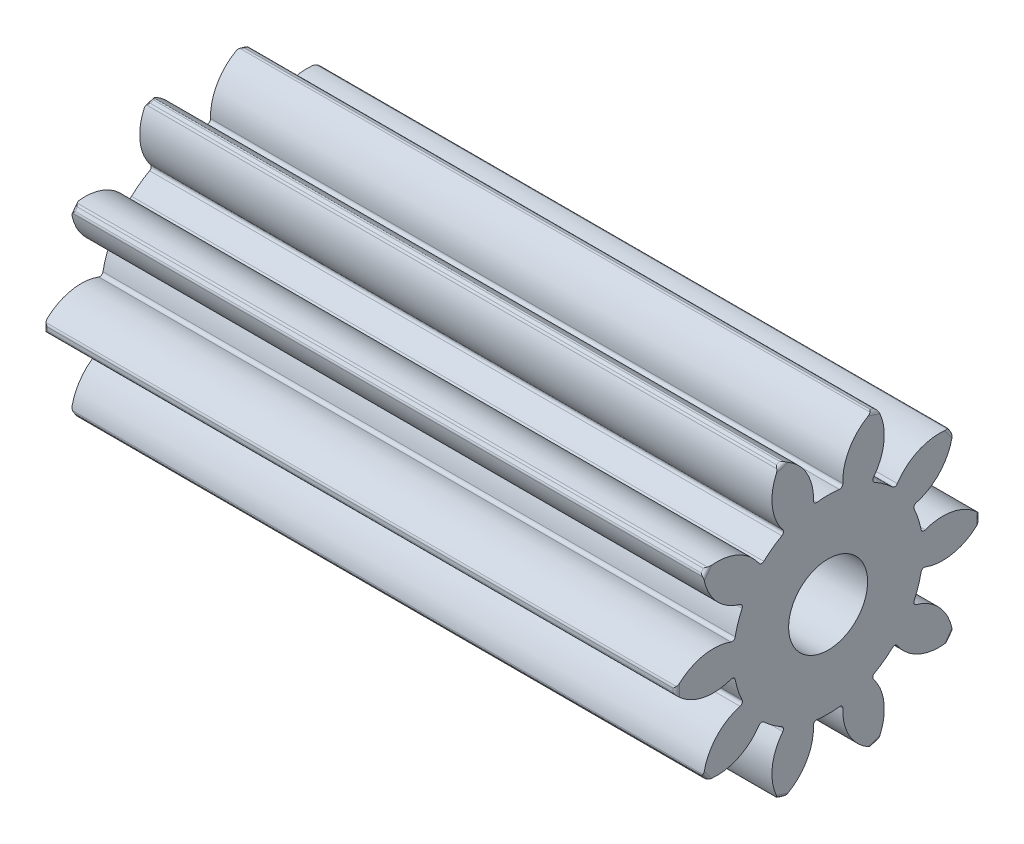
from build123d import *

# Parameters (mm, degrees)
BASPROSKE_W        = 12
BASPROSKE_H        = 2.4
TOOTHCUT_DEPTH     = 13.470765814
TEETHCUTS_COUNT    = 10
TEETHCUTS_ANGLE    = 324
BORSKE_R           = 0.625
BORE_DEPTH         = 50.0000508
SKETCH1_W          = 16.707004502
SKETCH1_H          = 15.29962097
CUT_EXTRUDE1_DEPTH = 2
FILLET1_R          = 0.05
FILLET2_R          = 0.05
FILLET3_R          = 0.05


with BuildPart() as part:
    # BasProSke → Base-Revolve (revolve)
    with BuildSketch(Plane(origin=(0, 0, 0), x_dir=(1, 0, 0), z_dir=(0, 1, 0)), mode=Mode.PRIVATE) as base_revolve_sk:
        with Locations((6, 1.2)):
            Rectangle(BASPROSKE_W, BASPROSKE_H)
    revolve(base_revolve_sk.sketch.rotate(Axis((-10, 0, 0), (1, 0, 0)), 180), axis=Axis((-10, 0, 0), (1, 0, 0)))

    # TooCutSke → ToothCut (cut, through all)
    with BuildSketch(Plane(origin=(0, 0, 0), x_dir=(0, 0, -1), z_dir=(1, 0, 0))):
        with BuildLine():
            ThreePointArc((0.236921703, 1.480158474), (0, 1.499), (-0.236921703, 1.480158474))
            ThreePointArc((-0.236921703, 1.480158474), (-0.344088585, 1.979623237), (-0.731644645, 2.312414598))
            ThreePointArc((-0.731644645, 2.312414598), (0, 2.4254), (0.731644645, 2.312414598))
            ThreePointArc((0.731644645, 2.312414598), (0.344088585, 1.979623237), (0.236921703, 1.480158474))
        make_face()
    toothcut = extrude(amount=TOOTHCUT_DEPTH, mode=Mode.SUBTRACT)

    # TeethCuts: ToothCut ×10 about axis
    teethcuts_axis = Axis((-10, 0, 0), (1, 0, 0))
    for i in range(1, TEETHCUTS_COUNT):
        add(toothcut.rotate(teethcuts_axis, i * TEETHCUTS_ANGLE / (TEETHCUTS_COUNT - 1)), mode=Mode.SUBTRACT)

    # BorSke → Bore (cut, symmetric)
    with BuildSketch(Plane(origin=(0, 0, 0), x_dir=(0, 0, -1), z_dir=(1, 0, 0))):
        with Locations(Location((0, 0, 0), (0, 0, 180))):
            Circle(BORSKE_R)
    extrude(amount=BORE_DEPTH, both=True, mode=Mode.SUBTRACT)

    # Sketch1 → Cut-Extrude1 (cut)
    with BuildSketch(Plane(origin=(12, 0, 0), x_dir=(0, 0, -1), z_dir=(1, 0, 0))):
        with Locations((-3.850254661, -3.423093573)):
            Rectangle(SKETCH1_W, SKETCH1_H)
    extrude(amount=-CUT_EXTRUDE1_DEPTH, mode=Mode.SUBTRACT)

    # Fillet1
    fillet1_edges = [part.edges().sort_by_distance(p)[0] for p in [
        (5, -0.232068194, -1.480927194),
        (5, -0.682720052, -1.334501529),
    ]]
    fillet(fillet1_edges, radius=FILLET1_R)

    # Fillet2
    fillet2_edges = [part.edges().sort_by_distance(p)[0] for p in [
        (5, 0.682720052, -1.334501529),
        (5, 0.232068194, -1.480927194),
        (5, 1.336732442, -0.678341638),
        (5, 1.058214277, -1.061689005),
        (5, -1.058214277, -1.061689005),
        (5, -1.336732442, -0.678341638),
        (5, 0.232068194, 1.480927194),
        (5, 0.682720052, 1.334501529),
        (5, -0.682720052, 1.334501529),
        (5, -0.232068194, 1.480927194),
        (5, -1.480158474, -0.236921703),
        (5, -1.480158474, 0.236921703),
        (5, -1.336732442, 0.678341638),
        (5, -1.058214277, 1.061689005),
        (5, 1.058214277, 1.061689005),
        (5, 1.336732442, 0.678341638),
        (5, 1.480158474, 0.236921703),
        (5, 1.480158474, -0.236921703),
    ]]
    fillet(fillet2_edges, radius=FILLET2_R)

    # Fillet3
    fillet3_edges = [part.edges().sort_by_distance(p)[0] for p in [
        (5, 2.267252393, -0.78712552),
        (5, -1.449220375, -1.91305),
        (5, -0.047981335, -2.399520325),
        (5, 0.047981335, 2.399520325),
        (5, -1.371584944, 1.969455443),
        (5, -2.296906489, -0.695859597),
        (5, -2.267252393, 0.78712552),
        (5, 2.296906489, 0.695859597),
        (5, 0.047981335, -2.399520325),
        (5, 1.449220375, -1.91305),
        (5, -2.267252393, -0.78712552),
        (5, -1.371584944, -1.969455443),
        (5, 1.371584944, 1.969455443),
        (5, -0.047981335, 2.399520325),
        (5, -2.296906489, 0.695859597),
        (5, -1.449220375, 1.91305),
        (5, 2.267252393, 0.78712552),
        (5, 2.296906489, -0.695859597),
        (10, 0, 2.4),
        (10, 1.410684606, 1.941640786),
        (10, 2.282535639, 0.741640786),
        (10, 2.282535639, -0.741640786),
        (10, 1.410684606, -1.941640786),
        (10, 0, -2.4),
        (10, -1.410684606, -1.941640786),
        (10, -2.282535639, -0.741640786),
        (10, -2.282535639, 0.741640786),
        (10, -1.410684606, 1.941640786),
        (0, 2.282535639, 0.741640786),
        (5, 1.449220375, 1.91305),
        (0, 1.410684606, -1.941640786),
        (0, 0, -2.4),
        (0, -1.410684606, -1.941640786),
        (0, -2.282535639, -0.741640786),
        (0, -2.282535639, 0.741640786),
        (0, -1.410684606, 1.941640786),
        (0, 0, 2.4),
        (0, 1.410684606, 1.941640786),
        (5, 1.371584944, -1.969455443),
        (0, 2.282535639, -0.741640786),
    ]]
    fillet(fillet3_edges, radius=FILLET3_R)


solid = part.part
